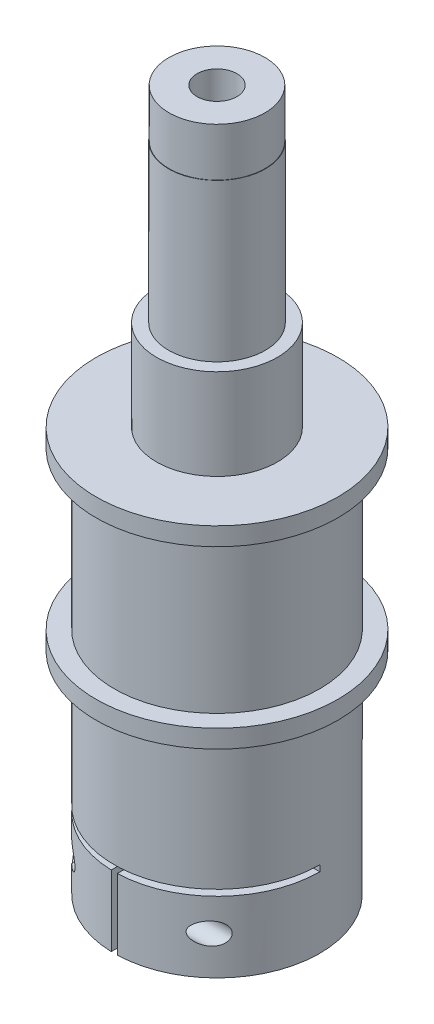
from build123d import *

# Parameters (mm, degrees)
CBORE_FOR_M1_6_SHCS1_D           = 1.8
CBORE_FOR_M1_6_SHCS1_CBORE_D     = 3.5
CBORE_FOR_M1_6_SHCS1_CBORE_DEPTH = 2.6
CUT_EXTRUDE1_REACH               = 55.998
CUT_EXTRUDE1_START               = -11.1
SKETCH4_W                        = 0.5
SKETCH4_H                        = 8.5
SKETCH5_W                        = 18
SKETCH5_H                        = 0.5
CUT_EXTRUDE2_DEPTH               = 43.898135158
M4X0_7_TAPPED_HOLE1_D            = 3.3
M4X0_7_TAPPED_HOLE1_DEPTH        = 10.1
M4X0_7_TAPPED_HOLE1_TIP          = 0.991420021


with BuildPart() as part:
    # Sketch1 → Revolve1 (revolve)
    with BuildSketch(Plane.XY):
        Polygon((-8.5, -17.45), (-8.5, 0), (-10, 0), (-10, 1.5), (-8.5, 1.5), (-8.5, 14.5), (-10, 14.5), (-10, 16), (-5, 16), (-5, 23.5), (-4, 23.5), (-4, 36.5), (-3.96875, 36.5), (-3.96875, 40.5), (0, 40.5), (0, 2.55), (-4, 2.55), (-4, -17.45), align=None)
    revolve(axis=Axis((0, 40.5, 0), (0, -1, 0)))

    # CBORE for M1.6 SHCS1 (through all)
    with Locations(Plane(origin=(-8.5, 0, 0), x_dir=(0, 0, -1), z_dir=(-1, 0, 0))):
        with Locations((-6.25, 14.275)):
            CounterBoreHole(CBORE_FOR_M1_6_SHCS1_D / 2, CBORE_FOR_M1_6_SHCS1_CBORE_D / 2, CBORE_FOR_M1_6_SHCS1_CBORE_DEPTH)

    # Sketch4 → Cut-Extrude1 (cut, up to next)
    with BuildSketch(Plane(origin=(0, 0, 0), x_dir=(1, 0, 0), z_dir=(0, 1, 0)).offset(CUT_EXTRUDE1_START), mode=Mode.PRIVATE) as cut_extrude1_sk1:
        with Locations((0, -4.25)):
            Rectangle(SKETCH4_W, SKETCH4_H)
    cut_extrude1_tool1 = extrude(cut_extrude1_sk1.sketch, amount=-CUT_EXTRUDE1_REACH, mode=Mode.PRIVATE) & part.part
    add(cut_extrude1_tool1.solids().sort_by_distance((0, -11.1, 4.25))[0], mode=Mode.SUBTRACT)

    # Sketch5 → Cut-Extrude2 (cut, through all)
    with BuildSketch(Plane.XY):
        with Locations((0, -11.35)):
            Rectangle(SKETCH5_W, SKETCH5_H)
    extrude(amount=CUT_EXTRUDE2_DEPTH, mode=Mode.SUBTRACT)

    # M4x0.7 Tapped Hole1
    with Locations(Plane(origin=(0, 40.5, 0), x_dir=(1, 0, 0), z_dir=(0, 1, 0))):
        with Locations((0, 0)):
            Hole(M4X0_7_TAPPED_HOLE1_D / 2, depth=M4X0_7_TAPPED_HOLE1_DEPTH)
            with Locations((0, 0, -(M4X0_7_TAPPED_HOLE1_DEPTH + M4X0_7_TAPPED_HOLE1_TIP / 2))):  # 118° drill point
                Cone(0, M4X0_7_TAPPED_HOLE1_D / 2, M4X0_7_TAPPED_HOLE1_TIP, mode=Mode.SUBTRACT)


solid = part.part
